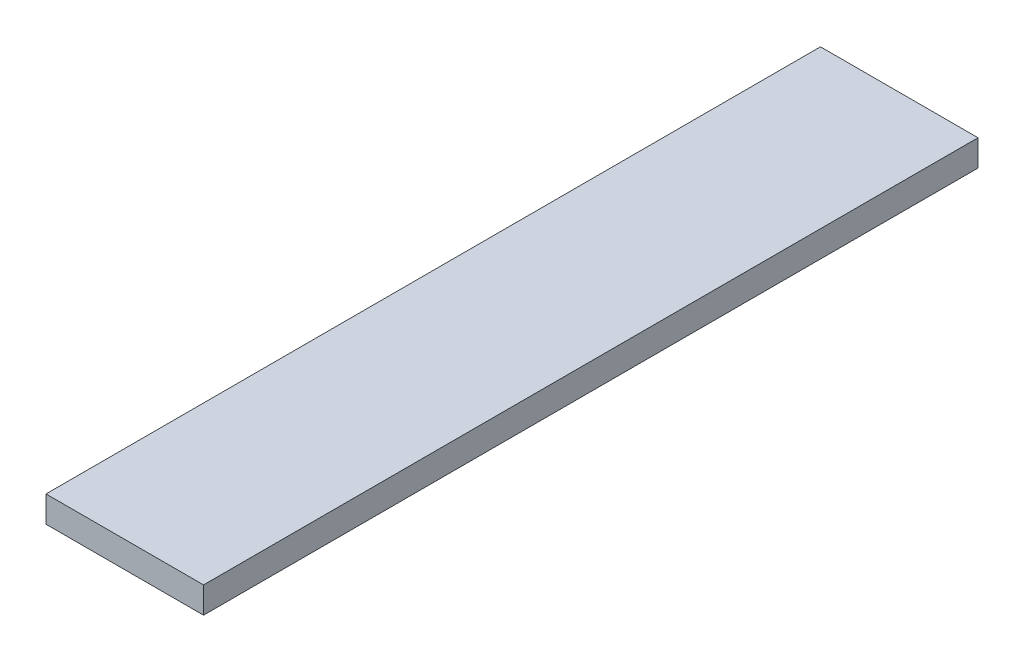
from build123d import *

# Parameters (mm, degrees)
SKETCH1_W           = 19.05
SKETCH1_H           = 3.175
BOSS_EXTRUDE1_DEPTH = 93.65


with BuildPart() as part:
    # Sketch1 → Boss-Extrude1 (new body)
    with BuildSketch(Plane.XY):
        Rectangle(SKETCH1_W, SKETCH1_H)
    extrude(amount=BOSS_EXTRUDE1_DEPTH)


solid = part.part
